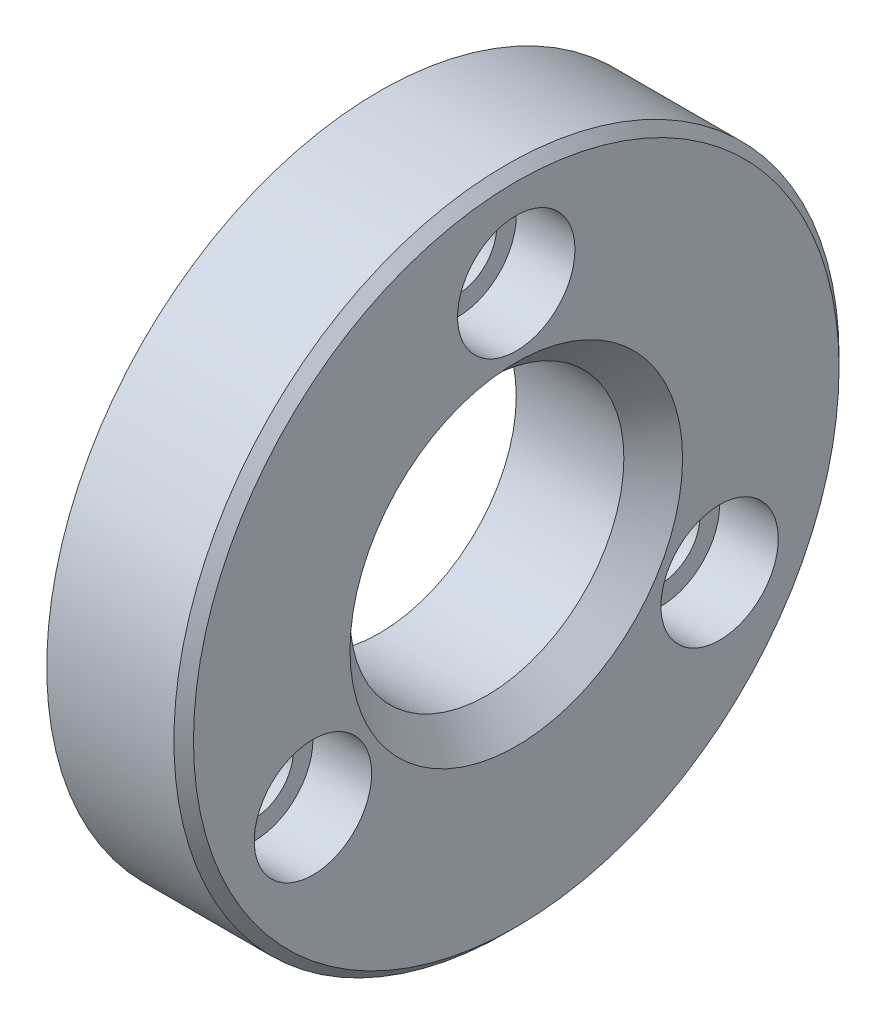
from build123d import *

# Parameters (mm, degrees)
SKETCH_1_R          = 17
SKETCH_1_R_2        = 7
SKETCH_1_R_3        = 2
EXTRUDE_1_DEPTH     = 7
SKETCH_2_R          = 3
CUT_EXTRUDE_1_DEPTH = 3
CHAMFER_1_SIZE      = 1.5
CHAMFER_2_SIZE      = 0.5


with BuildPart() as part:
    # 草图1 → 凸台-拉伸1 (new body)
    with BuildSketch(Plane(origin=(0, 0, 0), x_dir=(0, 0, -1), z_dir=(1, 0, 0))):
        Circle(SKETCH_1_R)
        Circle(SKETCH_1_R_2, mode=Mode.SUBTRACT)
        with Locations((0, 12)):
            Circle(SKETCH_1_R_3, mode=Mode.SUBTRACT)
        with Locations((10.392304845, -6)):
            Circle(SKETCH_1_R_3, mode=Mode.SUBTRACT)
        with Locations((-10.392304845, -6)):
            Circle(SKETCH_1_R_3, mode=Mode.SUBTRACT)
    extrude(amount=EXTRUDE_1_DEPTH)

    # 草图2 → 切除-拉伸1 (cut)
    with BuildSketch(Plane(origin=(7, 0, 0), x_dir=(0, 0, -1), z_dir=(1, 0, 0))):
        with Locations((0, 12)):
            Circle(SKETCH_2_R)
        with Locations((10.392304845, -6)):
            Circle(SKETCH_2_R)
        with Locations((-10.392304845, -6)):
            Circle(SKETCH_2_R)
    extrude(amount=-CUT_EXTRUDE_1_DEPTH, mode=Mode.SUBTRACT)

    # 倒角1
    chamfer_1_edges = [part.edges().sort_by_distance(p)[0] for p in [
        (7, 0, 7),
    ]]
    chamfer(chamfer_1_edges, length=CHAMFER_1_SIZE)

    # 倒角2
    chamfer_2_edges = [part.edges().sort_by_distance(p)[0] for p in [
        (7, 0, 17),
    ]]
    chamfer(chamfer_2_edges, length=CHAMFER_2_SIZE)


solid = part.part
